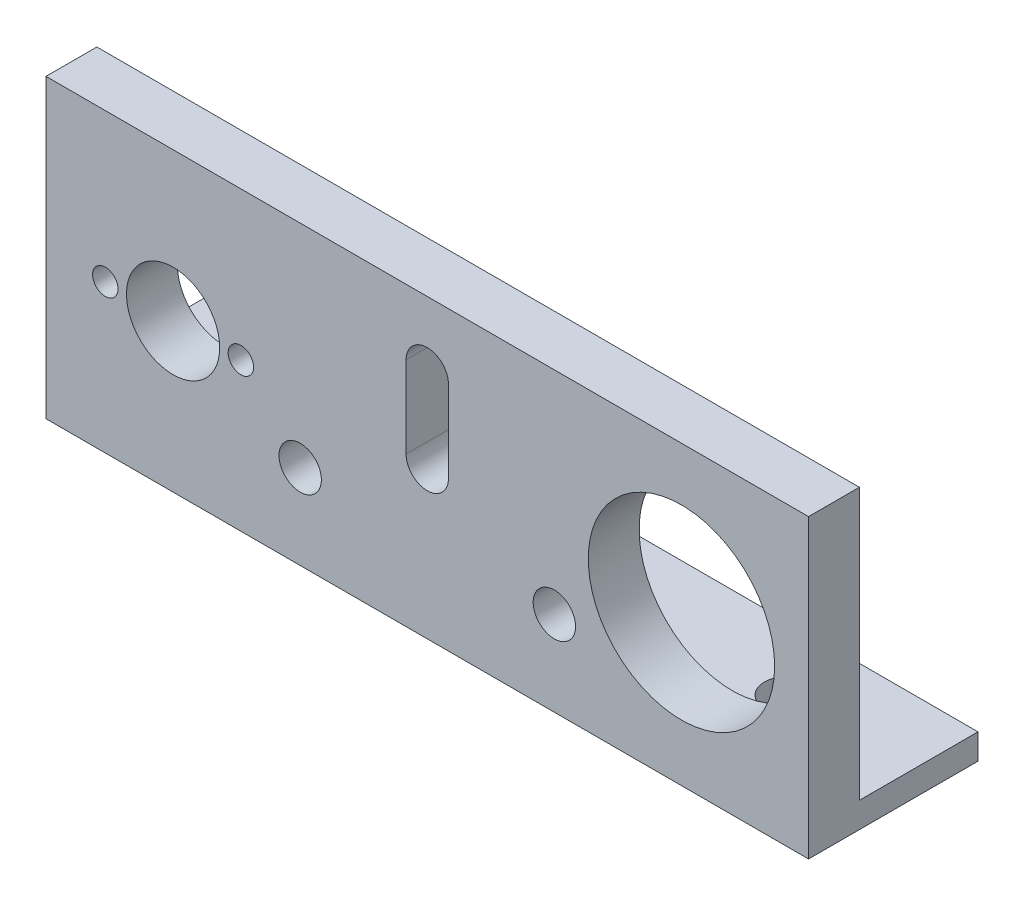
from build123d import *

# Parameters (mm, degrees)
SKETCH1_W           = 90
SKETCH1_H           = 35
SKETCH1_R           = 5.5
SKETCH1_R_2         = 1.5
SKETCH1_R_3         = 11
BOSS_EXTRUDE1_DEPTH = 6
SKETCH2_W           = 90
SKETCH2_H           = 3
BOSS_EXTRUDE2_DEPTH = 20
SKETCH4_R           = 2.5
CUT_EXTRUDE1_DEPTH  = 10
SKETCH5_R           = 2.7
CUT_EXTRUDE2_DEPTH  = 10


with BuildPart() as part:
    # Sketch1 → Boss-Extrude1 (new body)
    with BuildSketch(Plane.XY):
        Rectangle(SKETCH1_W, SKETCH1_H)
        with Locations((-30, 0)):
            Circle(SKETCH1_R, mode=Mode.SUBTRACT)
        with Locations((-38, 0)):
            Circle(SKETCH1_R_2, mode=Mode.SUBTRACT)
        with Locations((-22, 0)):
            Circle(SKETCH1_R_2, mode=Mode.SUBTRACT)
        with Locations((29.999666666, 0.2)):
            Circle(SKETCH1_R_3, mode=Mode.SUBTRACT)
    extrude(amount=BOSS_EXTRUDE1_DEPTH)

    # Sketch2 → Boss-Extrude2 (add)
    with BuildSketch(Plane.XY.offset(6)):
        with Locations((0, -16)):
            Rectangle(SKETCH2_W, SKETCH2_H)
    extrude(amount=-BOSS_EXTRUDE2_DEPTH)

    # Sketch4 → Cut-Extrude1 (cut)
    with BuildSketch(Plane.XY.offset(6)):
        with Locations((15, -7.5)):
            Circle(SKETCH4_R)
        with Locations(Location((-15, -7.5, 0), (0, 0, 180))):
            Circle(SKETCH4_R)
        with BuildLine():
            Line((2.5, 9.778989608), (2.5, 0.141519694))
            ThreePointArc((2.5, 0.141519694), (0, -2.358480306), (-2.5, 0.141519694))
            Line((-2.5, 0.141519694), (-2.5, 9.778989608))
            ThreePointArc((-2.5, 9.778989608), (0, 12.278989608), (2.5, 9.778989608))
        make_face()
    extrude(amount=-CUT_EXTRUDE1_DEPTH, mode=Mode.SUBTRACT)

    # Sketch5 → Cut-Extrude2 (cut)
    with BuildSketch(Plane(origin=(0, -14.5, 0), x_dir=(1, 0, 0), z_dir=(0, 1, 0))):
        with Locations(Location((30, 6.5, 0), (0, 0, 270))):
            Circle(SKETCH5_R)
        with Locations(Location((-30, 6.5, 0), (0, 0, 270))):
            Circle(SKETCH5_R)
    extrude(amount=-CUT_EXTRUDE2_DEPTH, mode=Mode.SUBTRACT)


solid = part.part
